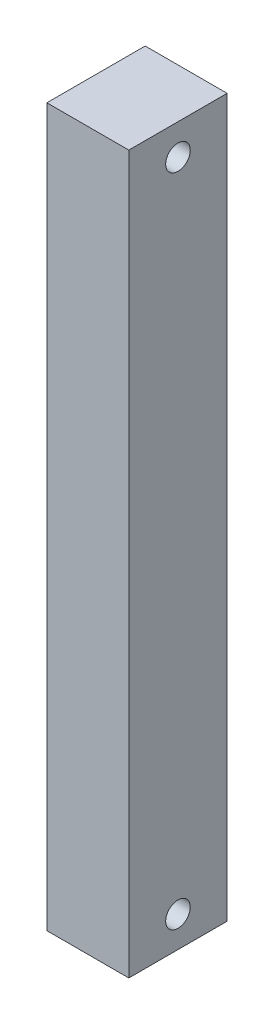
from build123d import *

# Parameters (mm, degrees)
SKETCH1_W           = 12
SKETCH1_H           = 87.5
SKETCH1_R           = 1.5
BOSS_EXTRUDE1_DEPTH = 5


with BuildPart() as part:
    # Sketch1 → Boss-Extrude1 (new, symmetric)
    with BuildSketch(Plane(origin=(0, 0, 0), x_dir=(0, 0, -1), z_dir=(1, 0, 0))):
        with Locations((0, 40)):
            Rectangle(SKETCH1_W, SKETCH1_H)
        with Locations((0, 80)):
            Circle(SKETCH1_R, mode=Mode.SUBTRACT)
        Circle(SKETCH1_R, mode=Mode.SUBTRACT)
    extrude(amount=BOSS_EXTRUDE1_DEPTH, both=True)


solid = part.part
